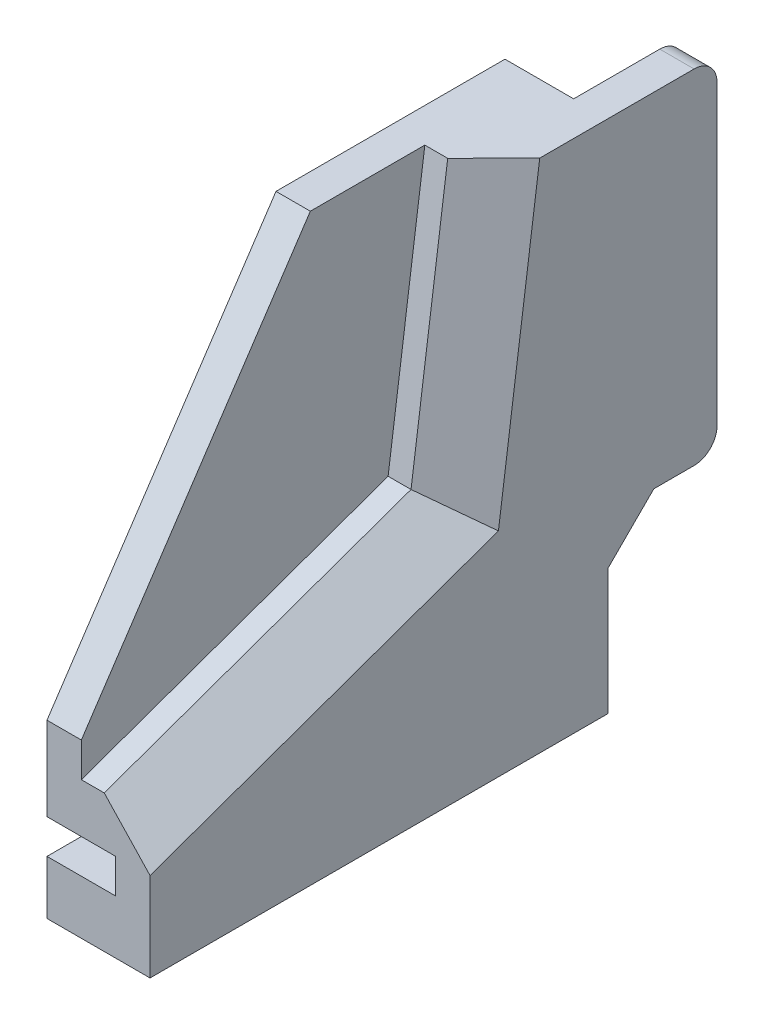
from build123d import *

# Parameters (mm, degrees)
SKETCH1_W           = 9
SKETCH1_H           = 45
SKETCH1_R           = 1.63195
BOSS_EXTRUDE1_DEPTH = 40
SKETCH1_3_R         = 1.63195
CUT_EXTRUDE1_DEPTH  = 10
SKETCH2_W           = 40
SKETCH2_H           = 3
CUT_EXTRUDE2_DEPTH  = 6
CUT_EXTRUDE3_DEPTH  = 9
CUT_EXTRUDE4_DEPTH  = 6
CHAMFER2_SIZE       = 4
SKETCH6_R           = 2.0193
CUT_EXTRUDE5_DEPTH  = 6
SKETCH7_W           = 3
SKETCH7_H           = 30
BOSS_EXTRUDE3_DEPTH = 9.52
CHAMFER3_SIZE       = 4
FILLET1_R           = 2
SKETCH8_W           = 73.917674983
SKETCH8_H           = 61.996597993
CUT_EXTRUDE6_DEPTH  = 9


with BuildPart() as part:
    # Sketch1 → Boss-Extrude1 (new body)
    # profile 1 of 3: a face of its own
    with BuildSketch(Plane.XY):
        with Locations((4.5, 22.5)):
            Rectangle(SKETCH1_W, SKETCH1_H)
        with Locations((6, 13)):
            Circle(SKETCH1_R, mode=Mode.SUBTRACT)
        with Locations((6, 25)):
            Circle(SKETCH1_R, mode=Mode.SUBTRACT)
    # profile 2 of 3: a face of its own
    with BuildSketch(Plane.XY):
        with Locations((6, 25)):
            Circle(SKETCH1_R)
    # profile 3 of 3: a face of its own
    with BuildSketch(Plane.XY):
        with Locations((6, 13)):
            Circle(SKETCH1_R)
    extrude(amount=BOSS_EXTRUDE1_DEPTH)

    # Sketch1<3> → Cut-Extrude1 (cut)
    with BuildSketch(Plane.XY):
        with Locations((6, 25)):
            Circle(SKETCH1_3_R)
        with Locations((6, 13)):
            Circle(SKETCH1_3_R)
    extrude(amount=CUT_EXTRUDE1_DEPTH, mode=Mode.SUBTRACT)

    # Sketch2 → Cut-Extrude2 (cut)
    with BuildSketch(Plane(origin=(9, 0, 0), x_dir=(0, 0, -1), z_dir=(1, 0, 0))):
        with Locations((-20, 6.2)):
            Rectangle(SKETCH2_W, SKETCH2_H)
    extrude(amount=-CUT_EXTRUDE2_DEPTH, mode=Mode.SUBTRACT)

    # Sketch3 → Cut-Extrude3 (cut)
    with BuildSketch(Plane(origin=(9, 0, 0), x_dir=(0, 0, -1), z_dir=(1, 0, 0))):
        Polygon((-20, 45), (-40, 15), (-48.379363257, 51.913157268), align=None)
    extrude(amount=-CUT_EXTRUDE3_DEPTH, mode=Mode.SUBTRACT)

    # Sketch5 → Cut-Extrude4 (cut)
    with BuildSketch(Plane.ZY):
        Polygon((20, 45), (10, 45), (13.204776383, 21.55213026), (40, 12), (40, 15), align=None)
    extrude(amount=-CUT_EXTRUDE4_DEPTH, mode=Mode.SUBTRACT)

    # Chamfer2
    chamfer2_edges = [part.edges().sort_by_distance(p)[0] for p in [
        (0, 33.27606513, 11.602388192),
        (0, 16.77606513, 26.602388192),
    ]]
    chamfer(chamfer2_edges, length=CHAMFER2_SIZE)

    # Sketch6 → Cut-Extrude5 (cut)
    with BuildSketch(Plane.XZ):
        with Locations(Location((5.5, 35, 0), (0, 0, 270))):
            Circle(SKETCH6_R)
        with Locations(Location((5.5, 20, 0), (0, 0, 270))):
            Circle(SKETCH6_R)
    extrude(amount=-CUT_EXTRUDE5_DEPTH, mode=Mode.SUBTRACT)

    # Sketch7 → Boss-Extrude3 (add)
    with BuildSketch(Plane(origin=(0, 0, 0), x_dir=(-1, 0, 0), z_dir=(0, 0, -1))):
        with Locations((-1.5, 30)):
            Rectangle(SKETCH7_W, SKETCH7_H)
    extrude(amount=BOSS_EXTRUDE3_DEPTH)

    # Chamfer3
    chamfer3_edges = [part.edges().sort_by_distance(p)[0] for p in [
        (1.5, 15, 0),
    ]]
    chamfer(chamfer3_edges, length=CHAMFER3_SIZE)

    # Fillet1
    fillet1_edges = [part.edges().sort_by_distance(p)[0] for p in [
        (1.5, 45, -9.52),
        (1.5, 15, -9.52),
    ]]
    fillet(fillet1_edges, radius=FILLET1_R)

    # Mirror1: part across plane


with BuildPart() as part_1:
    add(part.part)
    add(part.part.mirror(Plane(origin=(9, 0, 40), x_dir=(0, 0, 1), z_dir=(-1, 0, 0))))

    # Sketch8 → Cut-Extrude6 (cut)
    with BuildSketch(Plane(origin=(0, 0, 0), x_dir=(0, 0, -1), z_dir=(1, 0, 0))):
        with Locations((-12.663539667, 19.880173389)):
            Rectangle(SKETCH8_W, SKETCH8_H)
    extrude(amount=CUT_EXTRUDE6_DEPTH, mode=Mode.SUBTRACT)


solid = part_1.part
